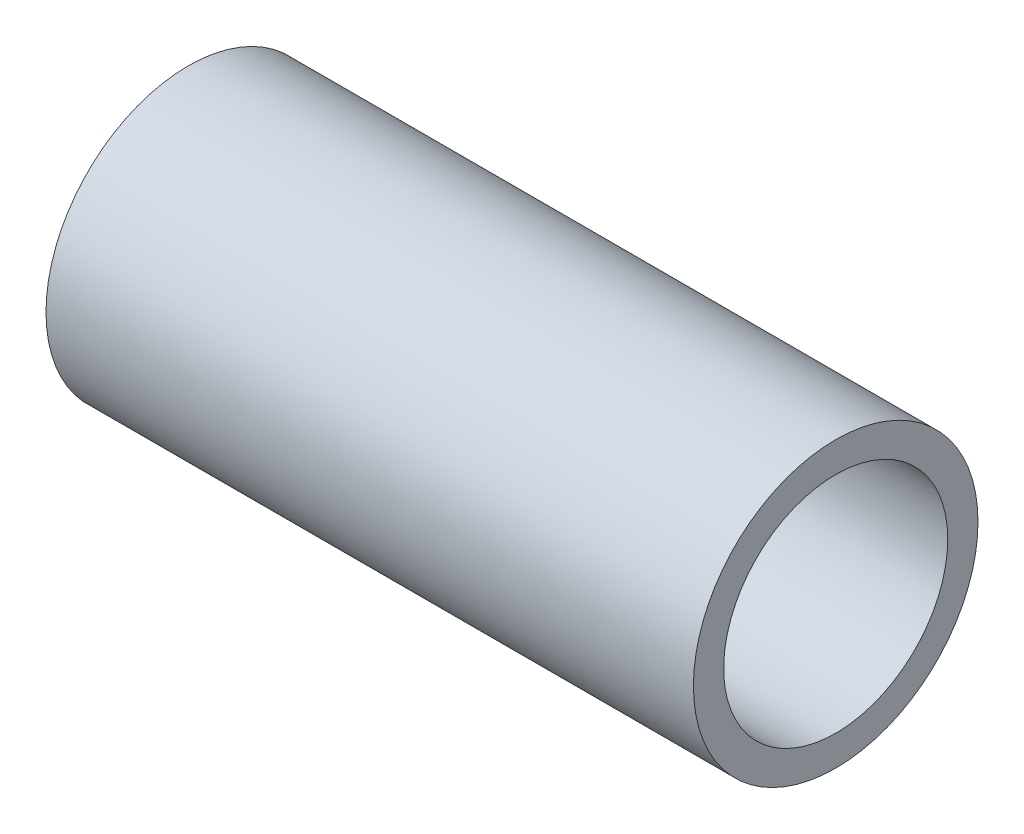
from build123d import *

# Parameters (mm, degrees)
SKETCH1_R           = 10.16
SKETCH1_R_2         = 6.35
BOSS_EXTRUDE2_DEPTH = 20.828
BOSS_EXTRUDE3_START = 12.7
SKETCH2_R           = 10.16
SKETCH2_R_2         = 8.001
BOSS_EXTRUDE3_DEPTH = 12.7
SKETCH3_R           = 10.16
SKETCH3_R_2         = 8.001
BOSS_EXTRUDE4_DEPTH = 12.7


with BuildPart() as part:
    # Sketch1 → Boss-Extrude2 (new body)
    with BuildSketch(Plane(origin=(0, 0, 0), x_dir=(0, 0, -1), z_dir=(1, 0, 0))):
        Circle(SKETCH1_R)
        Circle(SKETCH1_R_2, mode=Mode.SUBTRACT)
    extrude(amount=BOSS_EXTRUDE2_DEPTH)

    # Sketch2 → Boss-Extrude3 (add)
    with BuildSketch(Plane.ZY.offset(BOSS_EXTRUDE3_START)):
        Circle(SKETCH2_R)
        Circle(SKETCH2_R_2, mode=Mode.SUBTRACT)
    extrude(amount=-BOSS_EXTRUDE3_DEPTH)

    # Sketch3 → Boss-Extrude4 (add)
    with BuildSketch(Plane(origin=(20.828, 0, 0), x_dir=(0, 0, -1), z_dir=(1, 0, 0))):
        with Locations(Location((0, 0, 0), (0, 0, 180))):
            Circle(SKETCH3_R)
        with Locations(Location((0, 0, 0), (0, 0, 180))):
            Circle(SKETCH3_R_2, mode=Mode.SUBTRACT)
    extrude(amount=BOSS_EXTRUDE4_DEPTH)


solid = part.part
